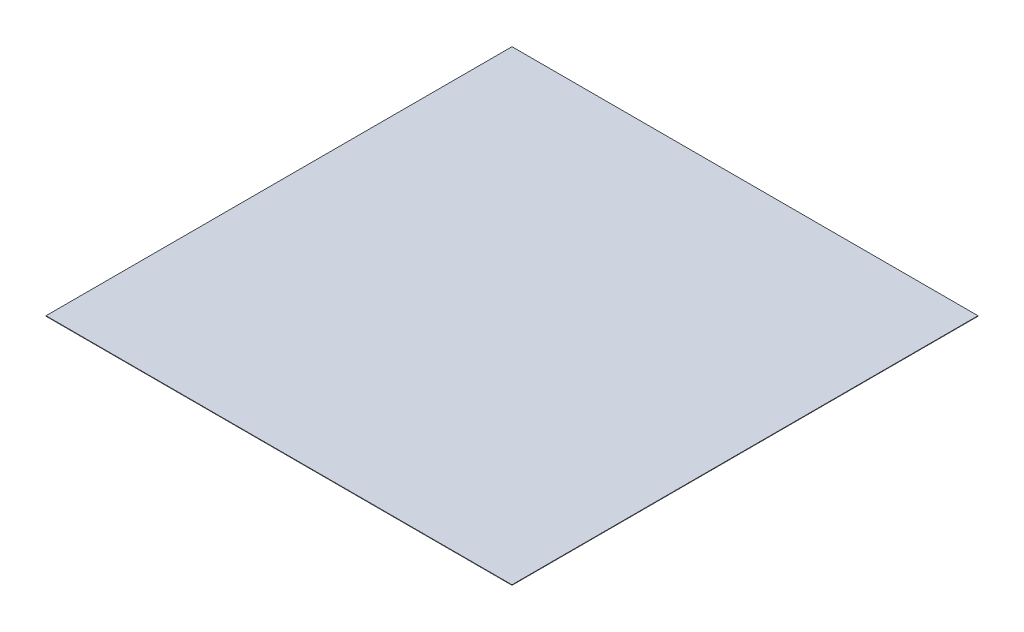
from build123d import *

# Parameters (mm, degrees)
SKETCH1_W           = 10000
SKETCH1_H           = 10000
BOSS_EXTRUDE1_DEPTH = 10


with BuildPart() as part:
    # Sketch1 → Boss-Extrude1 (new body)
    with BuildSketch(Plane(origin=(0, 0, 0), x_dir=(1, 0, 0), z_dir=(0, 1, 0))):
        Rectangle(SKETCH1_W, SKETCH1_H)
    extrude(amount=BOSS_EXTRUDE1_DEPTH)


solid = part.part
